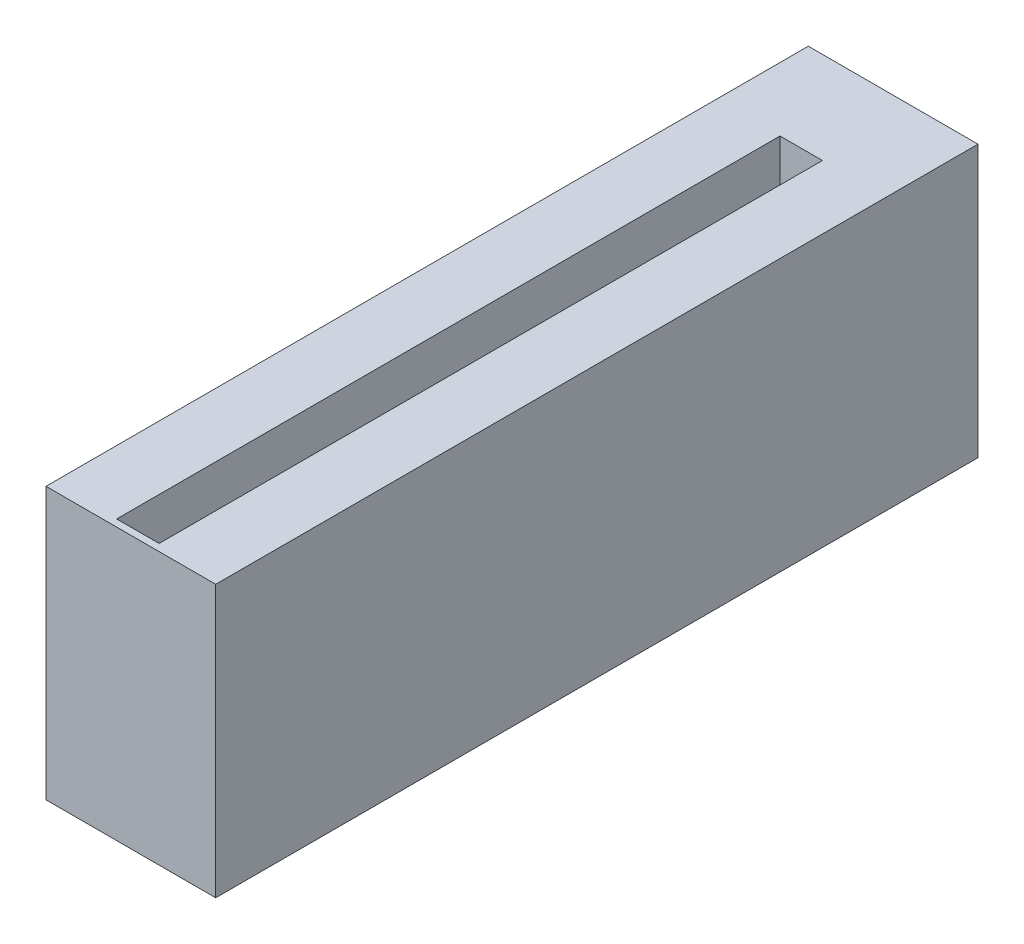
from build123d import *

# Parameters (mm, degrees)
SKETCH2_W           = 6
SKETCH2_H           = 26.95
BOSS_EXTRUDE1_DEPTH = 9.6
CUT_EXTRUDE2_DEPTH  = 9.6
SKETCH7_W           = 1.5
SKETCH7_H           = 0.25
BOSS_EXTRUDE2_DEPTH = 9.6
SKETCH8_W           = 1.5
SKETCH8_H           = 3.25
BOSS_EXTRUDE3_DEPTH = 9.6


with BuildPart() as part:
    # Sketch2 → Boss-Extrude1 (new body)
    with BuildSketch(Plane(origin=(0, 0, 0), x_dir=(1, 0, 0), z_dir=(0, 1, 0))):
        with Locations((3, 13.475)):
            Rectangle(SKETCH2_W, SKETCH2_H)
    extrude(amount=BOSS_EXTRUDE1_DEPTH)

    # Sketch3 → Cut-Extrude2 (cut)
    with BuildSketch(Plane(origin=(0, 9.6, 0), x_dir=(1, 0, 0), z_dir=(0, 1, 0))):
        Polygon((3, 26.95), (2.25, 26.95), (2.25, 0), (3.75, 0), (3.75, 26.95), align=None)
    extrude(amount=-CUT_EXTRUDE2_DEPTH, mode=Mode.SUBTRACT)


with BuildPart() as cut_extrude2_piece_1:
    # of the separate pieces the step leaves, piece 1, a body of its own (cut_extrude2_pieces)
    add(part.part.solids().sort_by_distance((6, 0, 0))[0])



with BuildPart() as cut_extrude2_piece_2:
    # of the separate pieces the step leaves, piece 2, a body of its own (cut_extrude2_pieces)
    add(part.part.solids().sort_by_distance((0, 0, 0))[0])


with BuildPart() as cut_extrude2_piece_1_1:
    add(cut_extrude2_piece_1.part)

    add(cut_extrude2_piece_2.part)  # Boss-Extrude2 merges Cut-Extrude2 piece 2
    # Sketch7 → Boss-Extrude2 (add)
    with BuildSketch(Plane(origin=(0, 9.6, 0), x_dir=(1, 0, 0), z_dir=(0, 1, 0))):
        with Locations((3, 0.125)):
            Rectangle(SKETCH7_W, SKETCH7_H)
    extrude(amount=-BOSS_EXTRUDE2_DEPTH)

    # Sketch8 → Boss-Extrude3 (add)
    with BuildSketch(Plane(origin=(0, 9.6, 0), x_dir=(1, 0, 0), z_dir=(0, 1, 0))):
        with Locations((3, 25.325)):
            Rectangle(SKETCH8_W, SKETCH8_H)
    extrude(amount=-BOSS_EXTRUDE3_DEPTH)


solid = cut_extrude2_piece_1_1.part
